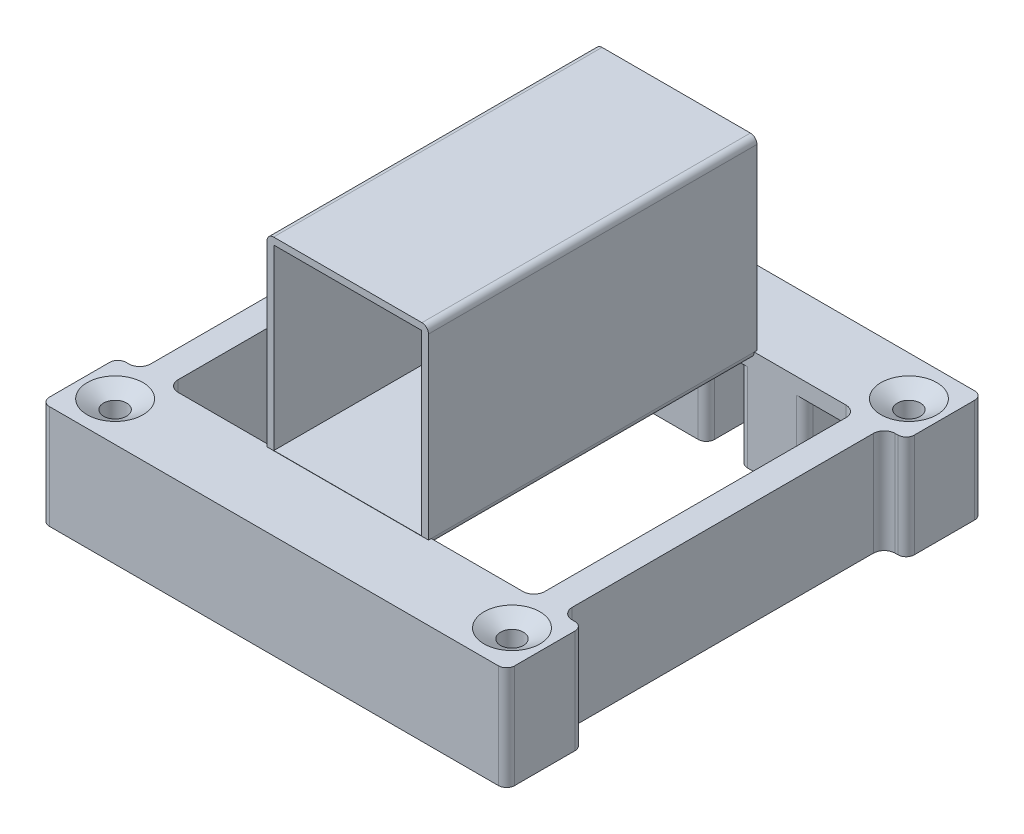
from build123d import *
from OCP.BRepFilletAPI import BRepFilletAPI_MakeChamfer

# Parameters (mm, degrees)
SKETCH1_W               = 27
SKETCH1_H               = 32.5
BOSS_EXTRUDE1_DEPTH     = 30
SKETCH2_W               = 14
SKETCH2_H               = 18.95
BOSS_EXTRUDE2_DEPTH     = 42.5
SKETCH3_W               = 6
SKETCH3_H               = 10
CUT_EXTRUDE1_DEPTH      = 16
FILLET1_R               = 1.49
CUT_EXTRUDE2_DEPTH      = 70.576863971
CUT_EXTRUDE2_DEPTH_BACK = 70.576863971
SKETCH4_R               = 2.1
CHAMFER1_SIZE           = 3
CHAMFER1_SIZE2          = 1.732050808
SKETCH5_W               = 5
SKETCH5_H               = 18.95
BOSS_EXTRUDE3_DEPTH     = 59
FILLET2_R               = 2


with BuildPart() as part:
    # Sketch1 → Boss-Extrude1 (new, symmetric)
    with BuildSketch(Plane.XY):
        with BuildLine():
            Line((14.75, -16.3), (14.75, 16.3))
            ThreePointArc((14.75, 16.3), (14.398528137, 17.148528137), (13.55, 17.5))
            Line((13.55, 17.5), (-13.55, 17.5))
            ThreePointArc((-13.55, 17.5), (-14.398528137, 17.148528137), (-14.75, 16.3))
            Line((-14.75, 16.3), (-14.75, -16.3))
            ThreePointArc((-14.75, -16.3), (-14.398528137, -17.148528137), (-13.55, -17.5))
            Line((-13.55, -17.5), (13.55, -17.5))
            ThreePointArc((13.55, -17.5), (14.398528137, -17.148528137), (14.75, -16.3))
        make_face()
        Rectangle(SKETCH1_W, SKETCH1_H, mode=Mode.SUBTRACT)
    extrude(amount=BOSS_EXTRUDE1_DEPTH, both=True)

    # Sketch2 → Boss-Extrude2 (add, symmetric)
    with BuildSketch(Plane(origin=(0, 0, 0), x_dir=(0, 0, -1), z_dir=(1, 0, 0))):
        with Locations((-36.5, -25.775)):
            Rectangle(SKETCH2_W, SKETCH2_H)
        with Locations((36.5, -25.775)):
            Rectangle(SKETCH2_W, SKETCH2_H)
    extrude(amount=BOSS_EXTRUDE2_DEPTH, both=True)

    # Sketch3 → Cut-Extrude1 (cut)
    with BuildSketch(Plane.XZ.offset(35.25)):
        with Locations((-27, 34.5)):
            Rectangle(SKETCH3_W, SKETCH3_H)
        with Locations((-9, 34.5)):
            Rectangle(SKETCH3_W, SKETCH3_H)
        with Locations((27, 34.5)):
            Rectangle(SKETCH3_W, SKETCH3_H)
        with Locations((9, 34.5)):
            Rectangle(SKETCH3_W, SKETCH3_H)
        with Locations((9, -34.5)):
            Rectangle(SKETCH3_W, SKETCH3_H)
        with Locations((27, -34.5)):
            Rectangle(SKETCH3_W, SKETCH3_H)
        with Locations((-9, -34.5)):
            Rectangle(SKETCH3_W, SKETCH3_H)
        with Locations((-27, -34.5)):
            Rectangle(SKETCH3_W, SKETCH3_H)
    extrude(amount=-CUT_EXTRUDE1_DEPTH, mode=Mode.SUBTRACT)

    # Fillet1
    fillet1_edges = [part.edges().sort_by_distance(p)[0] for p in [
        (6, -27.25, -39.5),
        (12, -27.25, 39.5),
        (12, -27.25, 29.5),
        (6, -27.25, 29.5),
        (6, -27.25, 39.5),
        (30, -27.25, 39.5),
        (30, -27.25, 29.5),
        (24, -27.25, 29.5),
        (24, -27.25, 39.5),
        (-12, -27.25, 29.5),
        (-12, -27.25, 39.5),
        (-6, -27.25, 39.5),
        (-6, -27.25, 29.5),
        (24, -27.25, -29.5),
        (30, -27.25, -29.5),
        (30, -27.25, -39.5),
        (24, -27.25, -39.5),
        (-12, -27.25, -29.5),
        (-6, -27.25, -29.5),
        (-6, -27.25, -39.5),
        (-12, -27.25, -39.5),
        (-30, -27.25, -29.5),
        (-24, -27.25, -29.5),
        (-24, -27.25, -39.5),
        (-30, -27.25, -39.5),
        (-30, -27.25, 29.5),
        (-30, -27.25, 39.5),
        (-24, -27.25, 39.5),
        (-24, -27.25, 29.5),
        (-42.5, -25.775, 29.5),
        (-42.5, -25.775, 43.5),
        (42.5, -25.775, 29.5),
        (42.5, -25.775, 43.5),
        (-42.5, -25.775, -29.5),
        (-42.5, -25.775, -43.5),
        (42.5, -25.775, -29.5),
        (42.5, -25.775, -43.5),
        (6, -27.25, -29.5),
        (12, -27.25, -29.5),
        (12, -27.25, -39.5),
    ]]
    fillet(fillet1_edges, radius=FILLET1_R)

    # Sketch4 → Cut-Extrude2 (cut, two sides: drawn at the far end of the back side and taken through both)
    with BuildSketch(Plane(origin=(0, -16.3, 0), x_dir=(1, 0, 0), z_dir=(0, 1, 0)).offset(-CUT_EXTRUDE2_DEPTH_BACK)):
        with Locations(Location((36.25, -36.25, 0), (0, 0, 270))):
            Circle(SKETCH4_R)
        with Locations(Location((-36.25, -36.25, 0), (0, 0, 90))):
            Circle(SKETCH4_R)
        with Locations(Location((-36.25, 36.25, 0), (0, 0, 270))):
            Circle(SKETCH4_R)
        with Locations(Location((36.25, 36.25, 0), (0, 0, 90))):
            Circle(SKETCH4_R)
    extrude(amount=CUT_EXTRUDE2_DEPTH + CUT_EXTRUDE2_DEPTH_BACK, mode=Mode.SUBTRACT)

    # Chamfer1: one chamfer whose edges measure the first distance from different faces: ONE call of the kernel's chamfer builder (chamfer() names one face for all edges)
    chamfer1_edges_1 = [part.edges().sort_by_distance(p)[0] for p in [
        (36.25, -16.3, -34.15),
        (-36.25, -16.3, -38.35),
    ]]
    chamfer1_side_1 = [part.faces().sort_by_distance(p)[0] for p in [
        (0, -16.3, -36.592952532),
    ]]
    chamfer1_edges_2 = [part.edges().sort_by_distance(p)[0] for p in [
        (-36.25, -16.3, 38.35),
        (36.25, -16.3, 34.15),
    ]]
    chamfer1_side_2 = [part.faces().sort_by_distance(p)[0] for p in [
        (0, -16.3, 36.592952532),
    ]]
    chamfer1 = BRepFilletAPI_MakeChamfer(part.part.solid().wrapped)
    for e in chamfer1_edges_1:
        chamfer1.Add(CHAMFER1_SIZE, CHAMFER1_SIZE2, e.wrapped, chamfer1_side_1[0].wrapped)  # the first distance lies on this face
    for e in chamfer1_edges_2:
        chamfer1.Add(CHAMFER1_SIZE, CHAMFER1_SIZE2, e.wrapped, chamfer1_side_2[0].wrapped)  # the first distance lies on this face
    add(Compound.cast(chamfer1.Shape()), mode=Mode.REPLACE)

    # Sketch5 → Boss-Extrude3 (add)
    with BuildSketch(Plane.XY.offset(-29.5)):
        with Locations((-36, -25.775)):
            Rectangle(SKETCH5_W, SKETCH5_H)
        with Locations((36, -25.775)):
            Rectangle(SKETCH5_W, SKETCH5_H)
    extrude(amount=BOSS_EXTRUDE3_DEPTH)

    # Fillet2
    fillet2_edges = [part.edges().sort_by_distance(p)[0] for p in [
        (-38.5, -25.775, -29.5),
        (-33.5, -25.775, -29.5),
        (-38.5, -25.775, 29.5),
        (-33.5, -25.775, 29.5),
        (33.5, -25.775, -29.5),
        (38.5, -25.775, -29.5),
        (38.5, -25.775, 29.5),
        (33.5, -25.775, 29.5),
    ]]
    fillet(fillet2_edges, radius=FILLET2_R)


solid = part.part
